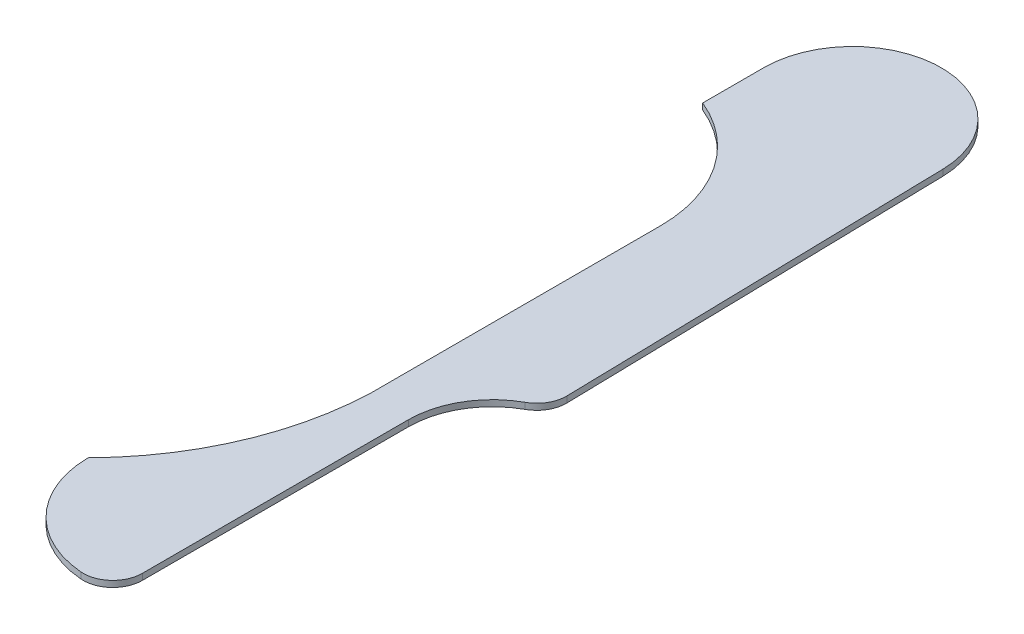
from build123d import *

# Parameters (mm, degrees)
BOSS_EXTRUDE1_DEPTH = 0.625


with BuildPart() as part:
    # Sketch1 → Boss-Extrude1 (new body)
    with BuildSketch(Plane(origin=(0, 0, 0), x_dir=(1, 0, 0), z_dir=(0, 1, 0))):
        with BuildLine():
            Line((8.997858244, 2.423307145), (9.848841271, -36.576692855))
            ThreePointArc((9.848841271, -36.576692855), (9.449049837, -38.139678019), (8.297497314, -39.26958182))
            ThreePointArc((8.297497314, -39.26958182), (5.081486735, -42.390887707), (3.9, -46.714007366))
            Line((3.9, -46.714007366), (3.9, -73.714007366))
            ThreePointArc((3.9, -73.714007366), (2.934734568, -75.918515302), (0.660096509, -76.704399701))
            ThreePointArc((0.660096509, -76.704399701), (-6.19183571, -73.385709721), (-9, -66.309206939))
            ThreePointArc((-9, -66.309206939), (-2.386951858, -56.128417461), (-0.35, -44.160472472))
            Line((-0.35, -44.160472472), (-0.35, -16.910472472))
            ThreePointArc((-0.35, -16.910472472), (-2.711701155, -9.129084421), (-9, -3.97302682))
            Line((-9, -3.97302682), (-9, 2.22697318))
            ThreePointArc((-9, 2.22697318), (-0.098172823, 11.226437725), (8.997858244, 2.423307145))
        make_face()
    extrude(amount=BOSS_EXTRUDE1_DEPTH)


solid = part.part
